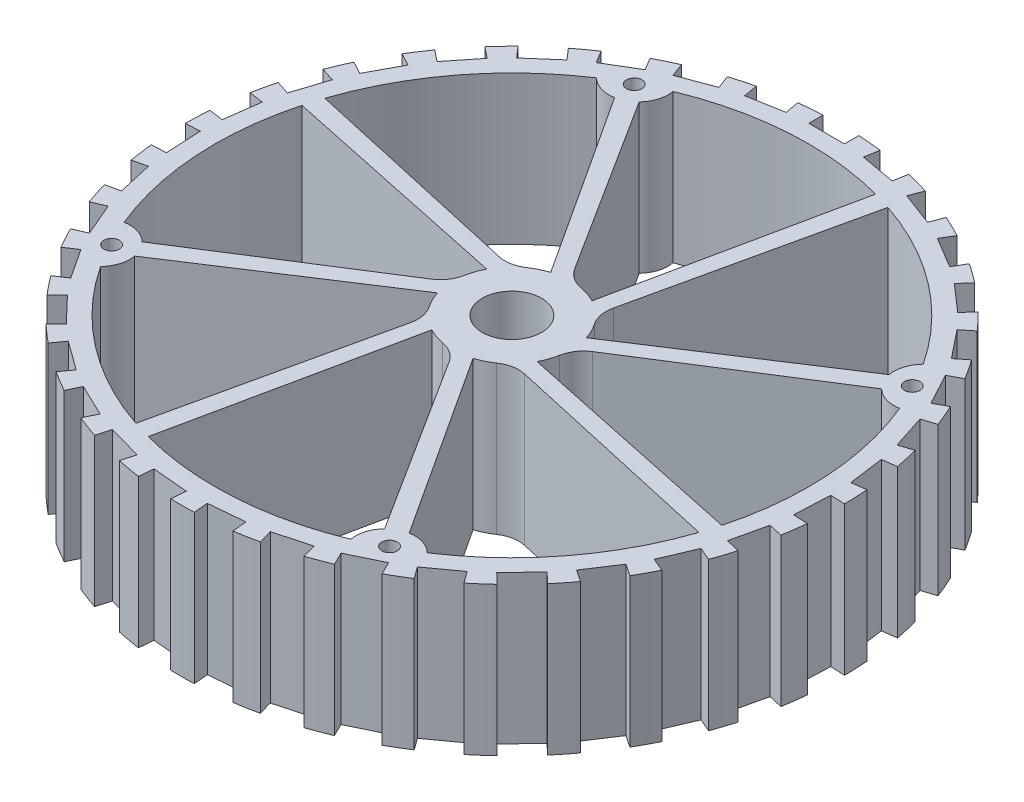
from build123d import *

# Parameters (mm, degrees)
SKETCH6_W           = 64.135
SKETCH6_H           = 31.75
CUT_EXTRUDE4_DEPTH  = 31.75
CIRPATTERN1_COUNT   = 8
SKETCH9_W           = 7.62
SKETCH9_H           = 5.600728512
CUT_EXTRUDE5_DEPTH  = 15.875
CIRPATTERN2_COUNT   = 35
FILLET1_R           = 6.35
BOSS_EXTRUDE1_DEPTH = 31.75
CIRPATTERN3_COUNT   = 4
SKETCH12_R          = 1.651
CUT_EXTRUDE7_DEPTH  = 31.75
CIRPATTERN4_COUNT   = 4


with BuildPart() as part:
    # Sketch6 → Revolve1 (revolve)
    with BuildSketch(Plane.XY):
        with Locations((38.4175, 0)):
            Rectangle(SKETCH6_W, SKETCH6_H)
    revolve(axis=Axis((0, 36.960013051, 0), (0, -1, 0)))

    # Sketch7 → Cut-Extrude4 (cut)
    with BuildSketch(Plane(origin=(0, 15.875, 0), x_dir=(1, 0, 0), z_dir=(0, 1, 0))):
        with BuildLine():
            Line((20.21016566, 60.198), (8.813470599, 9.144))
            ThreePointArc((8.813470599, 9.144), (10.798768491, 6.684055587), (12.115027858, 3.81))
            Line((12.115027858, 3.81), (54.99261314, 31.75))
            ThreePointArc((54.99261314, 31.75), (40.201824098, 49.153467214), (20.21016566, 60.198))
        make_face()
    cut_extrude4 = extrude(amount=-CUT_EXTRUDE4_DEPTH, mode=Mode.SUBTRACT)

    # CirPattern1: Cut-Extrude4 ×8 about axis
    cirpattern1_axis = Axis((0, 36.960013051, 0), (0, 1, 0))
    for i in range(1, CIRPATTERN1_COUNT):
        add(cut_extrude4.rotate(cirpattern1_axis, i * 360 / CIRPATTERN1_COUNT), mode=Mode.SUBTRACT)

    # Sketch9 → Cut-Extrude5 (cut, symmetric)
    with BuildSketch(Plane(origin=(0, 0, 0), x_dir=(1, 0, 0), z_dir=(0, 1, 0))):
        with Locations((0, 70.110364256)):
            Rectangle(SKETCH9_W, SKETCH9_H)
    cut_extrude5 = extrude(amount=CUT_EXTRUDE5_DEPTH, both=True, mode=Mode.SUBTRACT)

    # CirPattern2: Cut-Extrude5 ×35 about axis
    cirpattern2_axis = Axis((0, 36.960013051, 0), (0, 1, 0))
    for i in range(1, CIRPATTERN2_COUNT):
        add(cut_extrude5.rotate(cirpattern2_axis, i * 360 / CIRPATTERN2_COUNT), mode=Mode.SUBTRACT)

    # Fillet1
    fillet1_edges = [part.edges().sort_by_distance(p)[0] for p in [
        (-0.233719581, 0, -12.697849234),
        (12.697849234, 0, -0.233719581),
        (8.813470599, 0, -9.144),
        (9.144, 0, 8.813470599),
        (0.233719581, 0, 12.697849234),
        (-9.144, 0, -8.813470599),
        (-8.813470599, 0, 9.144),
        (-12.697849234, 0, 0.233719581),
    ]]
    fillet(fillet1_edges, radius=FILLET1_R)

    # Sketch11 → Boss-Extrude1 (add)
    with BuildSketch(Plane(origin=(0, 15.875, 0), x_dir=(1, 0, 0), z_dir=(0, 1, 0))):
        with BuildLine():
            Line((-36.195, 54.789198342), (-24.765, 60.325))
            ThreePointArc((-24.765, 60.325), (-27.712099171, 51.842099171), (-36.195, 54.789198342))
        make_face()
    boss_extrude1 = extrude(amount=-BOSS_EXTRUDE1_DEPTH)

    # CirPattern3: Boss-Extrude1 ×4 about axis
    cirpattern3_axis = Axis((0, 36.960013051, 0), (0, 1, 0))
    for i in range(1, CIRPATTERN3_COUNT):
        add(boss_extrude1.rotate(cirpattern3_axis, i * 360 / CIRPATTERN3_COUNT))

    # Sketch12 → Cut-Extrude7 (cut)
    with BuildSketch(Plane(origin=(0, 15.875, 0), x_dir=(1, 0, 0), z_dir=(0, 1, 0))):
        with Locations((-29.718, 55.88)):
            Circle(SKETCH12_R)
    cut_extrude7 = extrude(amount=-CUT_EXTRUDE7_DEPTH, mode=Mode.SUBTRACT)

    # CirPattern4: Cut-Extrude7 ×4 about axis
    cirpattern4_axis = Axis((0, 36.960013051, 0), (0, 1, 0))
    for i in range(1, CIRPATTERN4_COUNT):
        add(cut_extrude7.rotate(cirpattern4_axis, i * 360 / CIRPATTERN4_COUNT), mode=Mode.SUBTRACT)


solid = part.part
